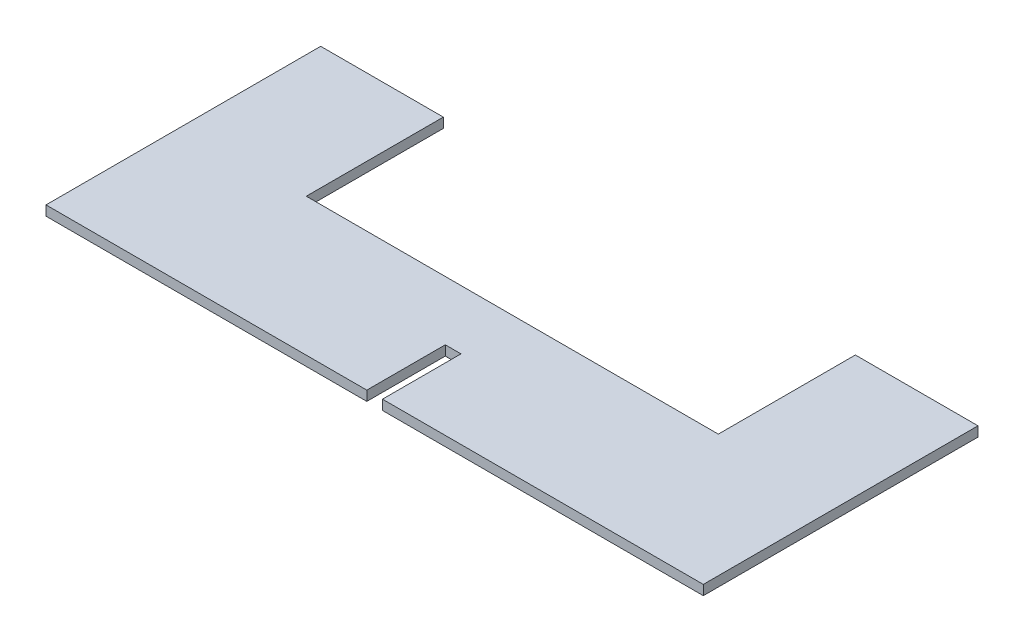
from build123d import *

# Parameters (mm, degrees)
SALIENTE_EXTRUIR1_DEPTH = 0.5


with BuildPart() as part:
    # Croquis1 → Saliente-Extruir1 (new body)
    with BuildSketch(Plane(origin=(0, 0, 0), x_dir=(1, 0, 0), z_dir=(0, 1, 0))):
        Polygon((0, 0), (16.35, 0), (16.35, 4), (17.15, 4), (17.15, 0), (33.5, 0), (33.5, 14), (27.25, 14), (27.25, 7.015152795), (6.25, 7.015152795), (6.25, 14), (0, 14), align=None)
    extrude(amount=SALIENTE_EXTRUIR1_DEPTH)


solid = part.part
